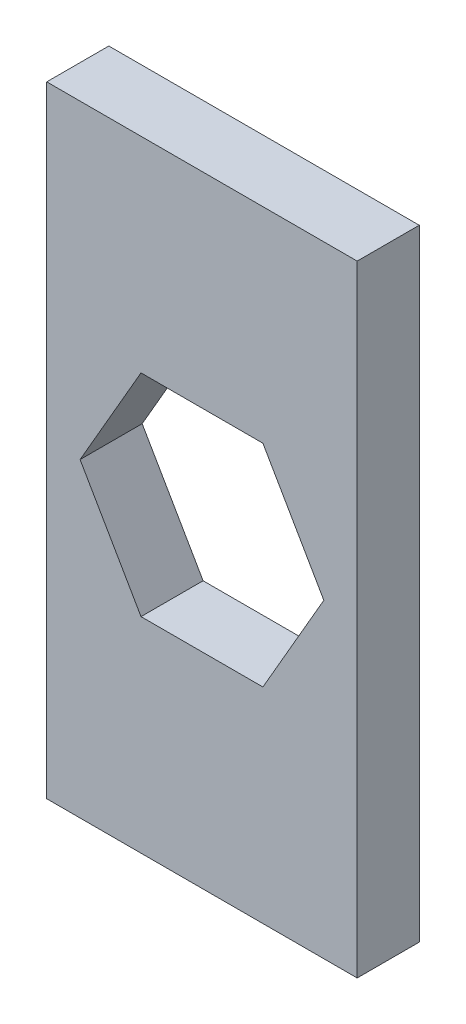
from build123d import *

# Parameters (mm, degrees)
SKETCH1_W           = 10
SKETCH1_H           = 20
BOSS_EXTRUDE1_DEPTH = 2


with BuildPart() as part:
    # Sketch1 → Boss-Extrude1 (new body)
    with BuildSketch(Plane.XY):
        with Locations((5, 10)):
            Rectangle(SKETCH1_W, SKETCH1_H)
        Polygon((6.962990915, 6.6), (8.92598183, 10), (6.962990915, 13.4), (3.037009085, 13.4), (1.07401817, 10), (3.037009085, 6.6), align=None, mode=Mode.SUBTRACT)
    extrude(amount=BOSS_EXTRUDE1_DEPTH)


solid = part.part
